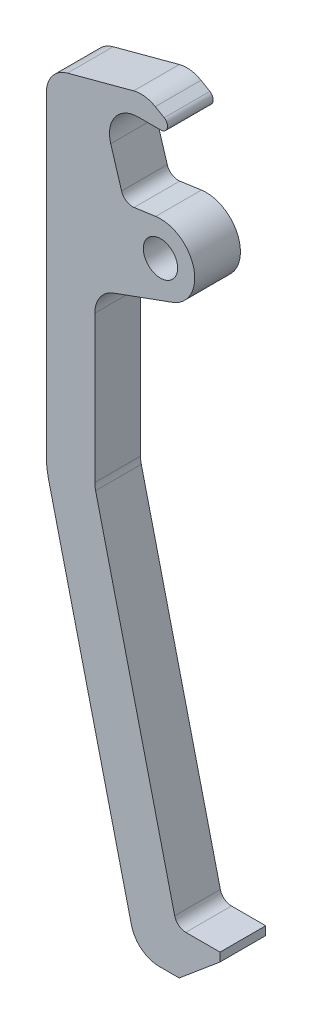
from build123d import *

# Parameters (mm, degrees)
ESQUISSE1_R        = 3
BOSS_EXTRU_1_DEPTH = 4


with BuildPart() as part:
    # Esquisse1 → Boss.-Extru.1 (new, symmetric)
    with BuildSketch(Plane.XY):
        with BuildLine():
            Line((-4.622690842, 5.411311669), (-0.831927473, 5.942044823))
            ThreePointArc((-0.831927473, 5.942044823), (5.822154168, 1.450007187), (2.05212086, -5.638155725))
            Line((2.05212086, -5.638155725), (-8.210100717, -9.373298916))
            ThreePointArc((-8.210100717, -9.373298916), (-10.595760221, -11.203879838), (-11.5, -14.07176202))
            Line((-11.5, -14.07176202), (-11.5, -39.742063683))
            ThreePointArc((-11.5, -39.742063683), (-11.465204853, -40.330910662), (-11.361303694, -40.911562034))
            Line((-11.361303694, -40.911562034), (2.485172244, -98.46779934))
            ThreePointArc((2.485172244, -98.46779934), (3.19187279, -99.570923085), (4.429693722, -100))
            Line((4.429693722, -100), (10.429693722, -100))
            Line((10.429693722, -100), (10.429693722, -101.5))
            Line((10.429693722, -101.5), (3.279172166, -107.5))
            Line((3.279172166, -107.5), (-0.220827834, -107.5))
            ThreePointArc((-0.220827834, -107.5), (-3.315380164, -106.427307714), (-5.082131528, -103.669498351))
            Line((-5.082131528, -103.669498351), (-19.583911082, -43.389332544))
            ThreePointArc((-19.583911082, -43.389332544), (-19.89561456, -41.647378427), (-20, -39.88083749))
            Line((-20, -39.88083749), (-20, 15.11916251))
            ThreePointArc((-20, 15.11916251), (-18.966766701, 18.162969655), (-16.294095226, 19.948791641))
            Line((-16.294095226, 19.948791641), (-4.70298531, 23.054620182))
            ThreePointArc((-4.70298531, 23.054620182), (-2.756259123, 23.182215358), (-0.908890085, 22.55511807))
            Line((-0.908890085, 22.55511807), (0.649955642, 21.65511807))
            ThreePointArc((0.649955642, 21.65511807), (1.191787733, 20.347019689), (0.068498187, 19.485089305))
            Line((0.068498187, 19.485089305), (-3.931501813, 19.485089305))
            ThreePointArc((-3.931501813, 19.485089305), (-7.950786116, 17.459203239), (-8.713025593, 13.023230781))
            Line((-8.713025593, 13.023230781), (-6.812609512, 6.807249868))
            ThreePointArc((-6.812609512, 6.807249868), (-5.975040779, 5.705491773), (-4.622690842, 5.411311669))
        make_face()
        Circle(ESQUISSE1_R, mode=Mode.SUBTRACT)
    extrude(amount=BOSS_EXTRU_1_DEPTH, both=True)


solid = part.part
